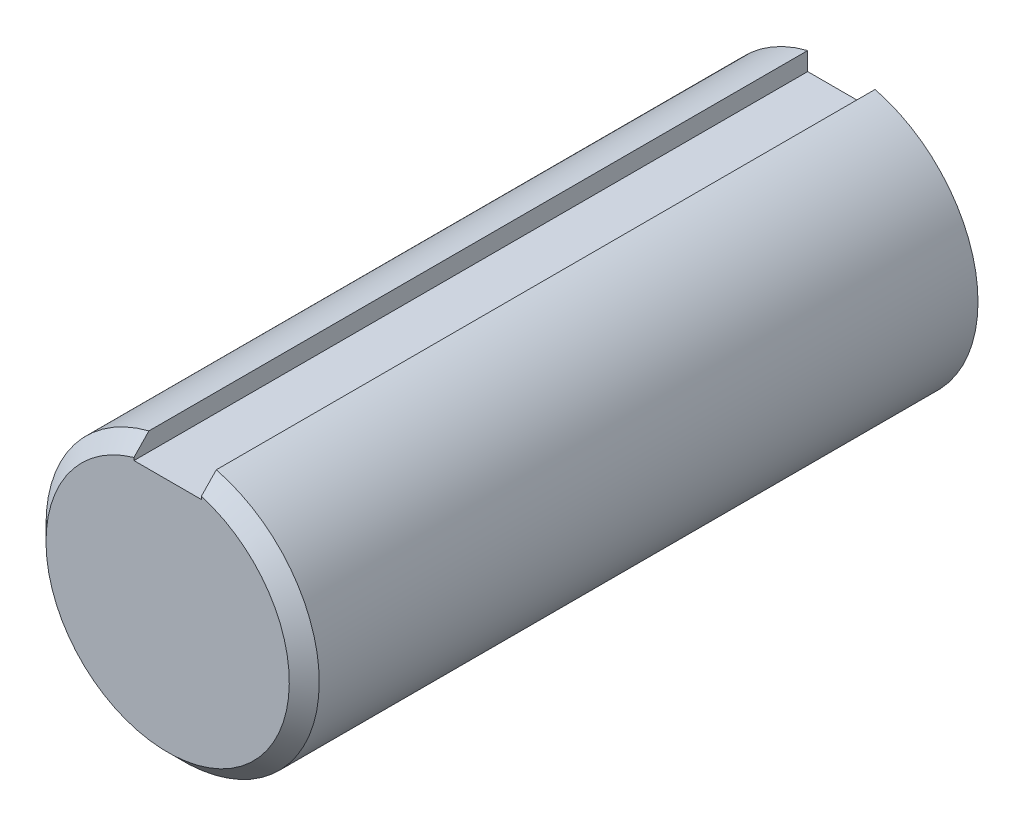
from build123d import *

# Parameters (mm, degrees)
SKETCH1_R           = 18.25
BOSS_EXTRUDE1_DEPTH = 90
SKETCH2_W           = 9
SKETCH2_H           = 6
CUT_EXTRUDE1_DEPTH  = 94.627586747
CHAMFER1_SIZE       = 2


with BuildPart() as part:
    # Sketch1 → Boss-Extrude1 (new body)
    with BuildSketch(Plane.XY):
        with Locations(Location((0, 0, 0), (0, 0, 180))):
            Circle(SKETCH1_R)
    extrude(amount=BOSS_EXTRUDE1_DEPTH)

    # Sketch2 → Cut-Extrude1 (cut, through all)
    with BuildSketch(Plane.XY.offset(90)):
        with Locations((0, 18.25)):
            Rectangle(SKETCH2_W, SKETCH2_H)
    extrude(amount=-CUT_EXTRUDE1_DEPTH, mode=Mode.SUBTRACT)

    # Chamfer1
    chamfer1_edges = [part.edges().sort_by_distance(p)[0] for p in [
        (0, -18.25, 90),
    ]]
    chamfer(chamfer1_edges, length=CHAMFER1_SIZE)


solid = part.part
